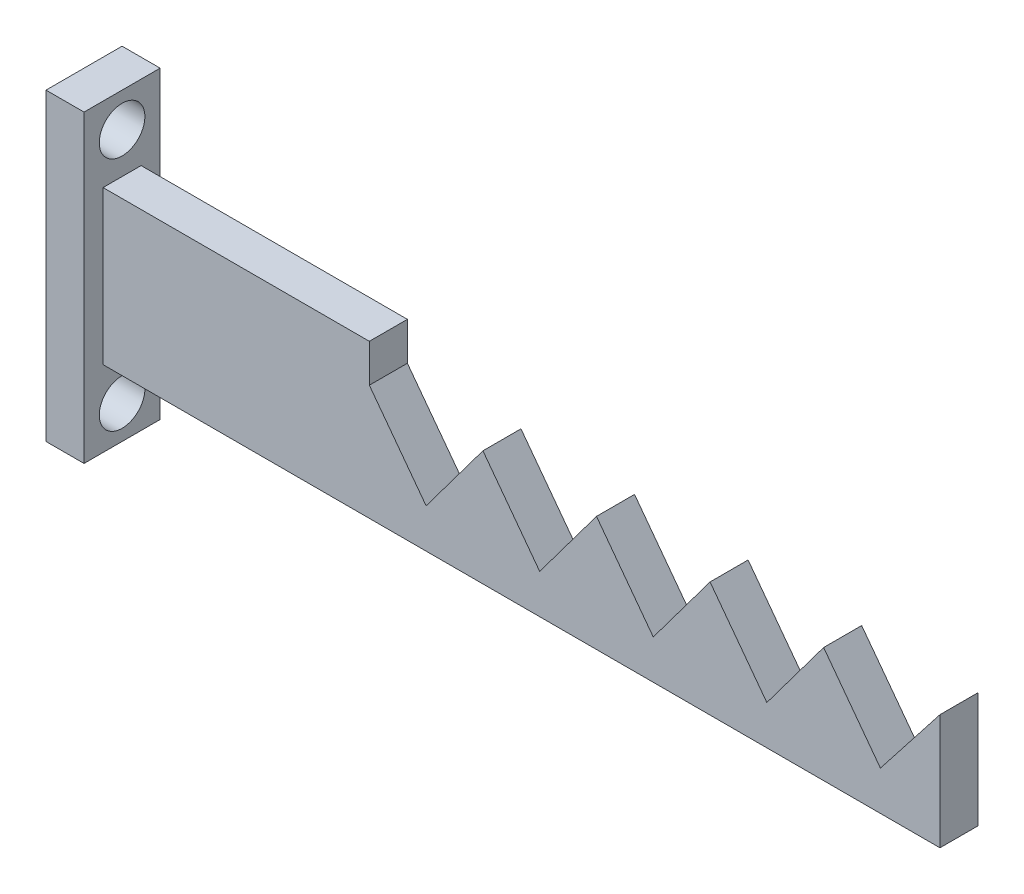
from build123d import *

# Parameters (mm, degrees)
BOSS_EXTRUDE1_DEPTH = 2.54
SKETCH2_W           = 5.08
SKETCH2_H           = 20.32
BOSS_EXTRUDE2_DEPTH = 2.54
SKETCH3_R           = 1.524
CUT_EXTRUDE1_DEPTH  = 2.54


with BuildPart() as part:
    # Sketch1 → Boss-Extrude1 (new body)
    with BuildSketch(Plane.XY):
        Polygon((-8.89, 0), (-8.89, 7.62), (8.89, 7.62), (8.89, 5.08), (12.681599437, 0), (16.473198875, 5.08), (20.264798312, 0), (24.056397749, 5.08), (27.847997187, 0), (31.639596624, 5.08), (35.431196061, 0), (39.222795499, 5.08), (43.014394936, 0), (46.99, 5.08), (46.99, 0), (46.99, -2.620396656), (-8.89, -2.620396656), align=None)
    extrude(amount=BOSS_EXTRUDE1_DEPTH)

    # Sketch2 → Boss-Extrude2 (add)
    with BuildSketch(Plane.ZY.offset(8.89)):
        with Locations((1.27, 2.459603344)):
            Rectangle(SKETCH2_W, SKETCH2_H)
    extrude(amount=BOSS_EXTRUDE2_DEPTH)

    # Sketch3 → Cut-Extrude1 (cut)
    with BuildSketch(Plane.ZY.offset(11.43)):
        with Locations((1.27, 10.333603344)):
            Circle(SKETCH3_R)
        with Locations(Location((1.27, -5.414396656, 0), (0, 0, 180))):
            Circle(SKETCH3_R)
    extrude(amount=-CUT_EXTRUDE1_DEPTH, mode=Mode.SUBTRACT)


solid = part.part
